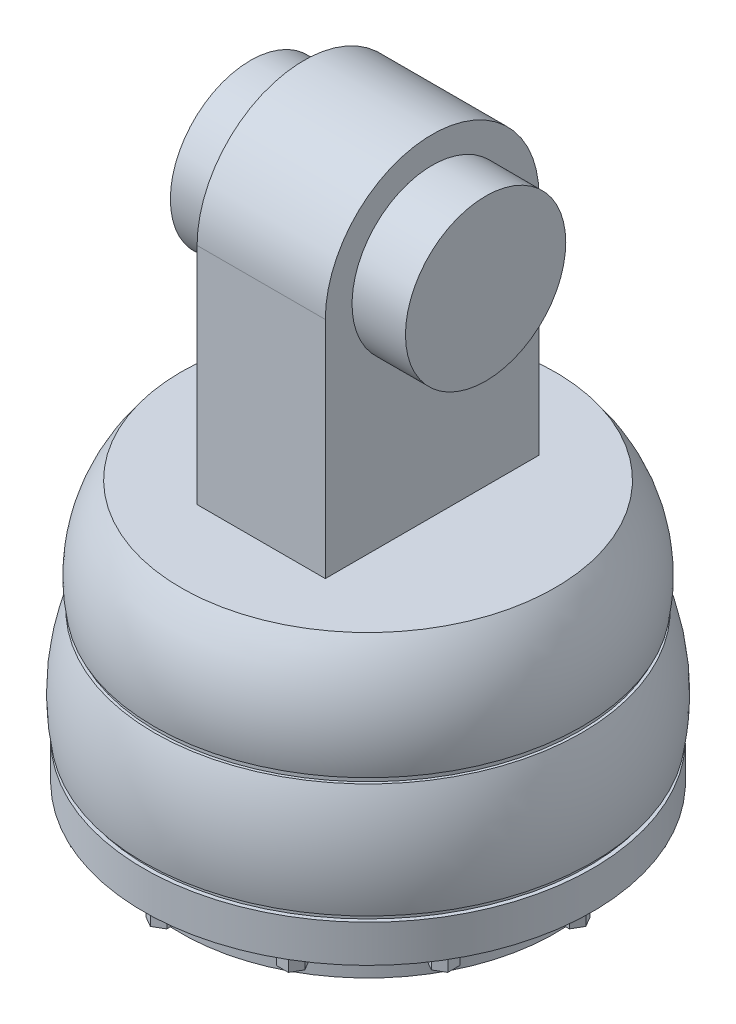
from build123d import *

# Parameters (mm, degrees)
SKETCH2_R            = 39.5
BOSS_EXTRUDE1_DEPTH  = 1
SKETCH4_R            = 41.25
BOSS_EXTRUDE2_DEPTH  = 1
SKETCH5_R            = 42
BOSS_EXTRUDE3_DEPTH  = 7
SKETCH6_R            = 35
BOSS_EXTRUDE4_DEPTH  = 7
BOSS_EXTRUDE5_DEPTH  = 3
CIRPATTERN1_COUNT    = 12
SKETCH8_R            = 15
BOSS_EXTRUDE6_DEPTH  = 10
SKETCH9_W            = 24
SKETCH9_H            = 40
BOSS_EXTRUDE7_DEPTH  = 42
BOSS_EXTRUDE8_START  = -24
BOSS_EXTRUDE8_DEPTH  = 24
SKETCH11_R           = 15
BOSS_EXTRUDE9_DEPTH  = 10
BOSS_EXTRUDE10_START = 10
SKETCH12_R           = 15
BOSS_EXTRUDE10_DEPTH = 10


with BuildPart() as part:
    # Sketch1 → Revolve1 (revolve)
    with BuildSketch(Plane.XY):
        with BuildLine():
            Line((-35, 0), (0, 0))
            Line((0, 0), (0, -20))
            Line((0, -20), (-40, -20))
            ThreePointArc((-40, -20), (-39.657515479, -9.46062113), (-35, 0))
        make_face()
    revolve(axis=Axis((0, 0, 0), (0, -1, 0)))

    # Sketch2 → Boss-Extrude1 (add)
    with BuildSketch(Plane.XZ.offset(20)):
        Circle(SKETCH2_R)
    extrude(amount=BOSS_EXTRUDE1_DEPTH)

    # Sketch3 → Revolve2 (revolve)
    with BuildSketch(Plane(origin=(0, 0, 0), x_dir=(0, 0, -1), z_dir=(1, 0, 0)), mode=Mode.PRIVATE) as revolve2_sk:
        with BuildLine():
            Line((0, -21), (-40, -21))
            ThreePointArc((-40, -21), (-42.384109041, -30.861589096), (-42, -41))
            Line((-42, -41), (0, -41))
            Line((0, -41), (0, -21))
        make_face()
    revolve(revolve2_sk.sketch.rotate(Axis((0, -21, 0), (0, -1, 0)), 90), axis=Axis((0, -21, 0), (0, -1, 0)))

    # Sketch4 → Boss-Extrude2 (add)
    with BuildSketch(Plane.XZ.offset(41)):
        with Locations(Location((0, 0, 0), (0, 0, 270))):
            Circle(SKETCH4_R)
    extrude(amount=BOSS_EXTRUDE2_DEPTH)

    # Sketch5 → Boss-Extrude3 (add)
    with BuildSketch(Plane.XZ.offset(42)):
        with Locations(Location((0, 0, 0), (0, 0, 270))):
            Circle(SKETCH5_R)
    extrude(amount=BOSS_EXTRUDE3_DEPTH)

    # Sketch6 → Boss-Extrude4 (add)
    with BuildSketch(Plane.XZ.offset(49)):
        with Locations(Location((0, 0, 0), (0, 0, 270))):
            Circle(SKETCH6_R)
    extrude(amount=BOSS_EXTRUDE4_DEPTH)

    # Sketch7 → Boss-Extrude5 (add)
    with BuildSketch(Plane.XZ.offset(49)):
        Polygon((36.25, 0), (37.375, -1.948557159), (39.625, -1.948557159), (40.75, 0), (39.625, 1.948557159), (37.375, 1.948557159), align=None)
        Polygon((39.047649731, 0.948557159), (37.952350269, 0.948557159), (37.404700538, 0), (37.952350269, -0.948557159), (39.047649731, -0.948557159), (39.595299462, 0), align=None, mode=Mode.SUBTRACT)
    boss_extrude5 = extrude(amount=BOSS_EXTRUDE5_DEPTH)

    # CirPattern1: Boss-Extrude5 ×12 about axis
    cirpattern1_axis = Axis((0, 0, 0), (0, 1, 0))
    for i in range(1, CIRPATTERN1_COUNT):
        add(boss_extrude5.rotate(cirpattern1_axis, i * 360 / CIRPATTERN1_COUNT))

    # Sketch8 → Boss-Extrude6 (add)
    with BuildSketch(Plane.XZ.offset(56)):
        with Locations(Location((0, 0, 0), (0, 0, 270))):
            Circle(SKETCH8_R)
    extrude(amount=BOSS_EXTRUDE6_DEPTH)

    # Sketch9 → Boss-Extrude7 (add)
    with BuildSketch(Plane(origin=(0, 0, 0), x_dir=(1, 0, 0), z_dir=(0, 1, 0))):
        Rectangle(SKETCH9_W, SKETCH9_H)
    extrude(amount=BOSS_EXTRUDE7_DEPTH)

    # Sketch10 → Boss-Extrude8 (add)
    with BuildSketch(Plane(origin=(12, 0, 0), x_dir=(0, 0, -1), z_dir=(1, 0, 0)).offset(BOSS_EXTRUDE8_START)):
        with BuildLine():
            Line((-20, 42), (20, 42))
            ThreePointArc((20, 42), (0, 62), (-20, 42))
        make_face()
    extrude(amount=BOSS_EXTRUDE8_DEPTH)

    # Sketch11 → Boss-Extrude9 (add)
    with BuildSketch(Plane.ZY.offset(12)):
        with Locations(Location((0, 42, 0), (0, 0, 90))):
            Circle(SKETCH11_R)
    extrude(amount=BOSS_EXTRUDE9_DEPTH)

    # Sketch12 → Boss-Extrude10 (add)
    with BuildSketch(Plane(origin=(12, 0, 0), x_dir=(0, 0, -1), z_dir=(1, 0, 0)).offset(BOSS_EXTRUDE10_START)):
        with Locations(Location((0, 42, 0), (0, 0, 90))):
            Circle(SKETCH12_R)
    extrude(amount=-BOSS_EXTRUDE10_DEPTH)


solid = part.part
